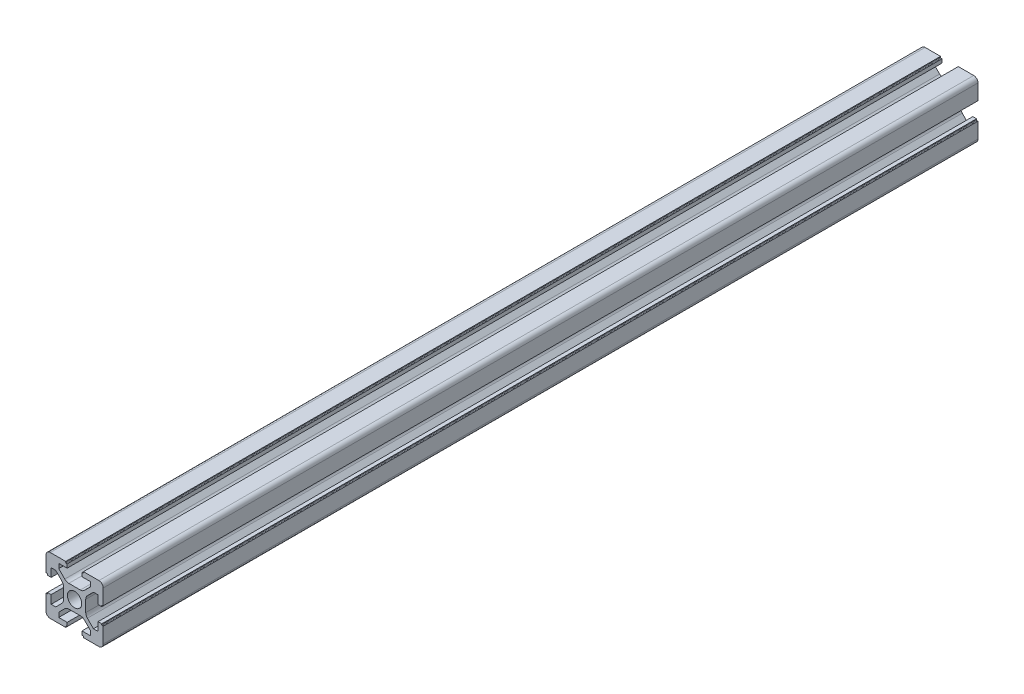
from build123d import *

# Parameters (mm, degrees)
SKETCH1_R      = 2.5
EXTRUDE1_DEPTH = 306


with BuildPart() as part:
    # Sketch1 → Extrude1 (new body)
    with BuildSketch(Plane.XY):
        with BuildLine():
            Line((0, 3.9), (-2.010912703, 3.9))
            ThreePointArc((-2.010912703, 3.9), (-2.776279568, 4.052240935), (-3.425126266, 4.485786438))
            Line((-3.425126266, 4.485786438), (-5.539339828, 6.6))
            Line((-5.539339828, 6.6), (-5.539339828, 8.2))
            Line((-5.539339828, 8.2), (-2.6, 8.2))
            Line((-2.6, 8.2), (-2.6, 9.5))
            Line((-2.6, 9.5), (-2.9, 9.5))
            ThreePointArc((-2.9, 9.5), (-3.041421356, 9.558578644), (-3.1, 9.7))
            Line((-3.1, 9.7), (-3.1, 10))
            Line((-3.1, 10), (-8.5, 10))
            ThreePointArc((-8.5, 10), (-9.560660172, 9.560660172), (-10, 8.5))
            Line((-10, 8.5), (-10, 3.1))
            Line((-10, 3.1), (-9.7, 3.1))
            ThreePointArc((-9.7, 3.1), (-9.558578644, 3.041421356), (-9.5, 2.9))
            Line((-9.5, 2.9), (-9.5, 2.6))
            Line((-9.5, 2.6), (-8.2, 2.6))
            Line((-8.2, 2.6), (-8.2, 5.539339828))
            Line((-8.2, 5.539339828), (-6.6, 5.539339828))
            Line((-6.6, 5.539339828), (-4.485786438, 3.425126266))
            ThreePointArc((-4.485786438, 3.425126266), (-4.052240935, 2.776279568), (-3.9, 2.010912703))
            Line((-3.9, 2.010912703), (-3.9, 0))
            Line((-3.9, 0), (-3.9, -2.010912703))
            ThreePointArc((-3.9, -2.010912703), (-4.052240935, -2.776279568), (-4.485786438, -3.425126266))
            Line((-4.485786438, -3.425126266), (-6.6, -5.539339828))
            Line((-6.6, -5.539339828), (-8.2, -5.539339828))
            Line((-8.2, -5.539339828), (-8.2, -2.6))
            Line((-8.2, -2.6), (-9.5, -2.6))
            Line((-9.5, -2.6), (-9.5, -2.9))
            ThreePointArc((-9.5, -2.9), (-9.558578644, -3.041421356), (-9.7, -3.1))
            Line((-9.7, -3.1), (-10, -3.1))
            Line((-10, -3.1), (-10, -8.5))
            ThreePointArc((-10, -8.5), (-9.560660172, -9.560660172), (-8.5, -10))
            Line((-8.5, -10), (-3.1, -10))
            Line((-3.1, -10), (-3.1, -9.7))
            ThreePointArc((-3.1, -9.7), (-3.041421356, -9.558578644), (-2.9, -9.5))
            Line((-2.9, -9.5), (-2.6, -9.5))
            Line((-2.6, -9.5), (-2.6, -8.2))
            Line((-2.6, -8.2), (-5.539339828, -8.2))
            Line((-5.539339828, -8.2), (-5.539339828, -6.6))
            Line((-5.539339828, -6.6), (-3.425126266, -4.485786438))
            ThreePointArc((-3.425126266, -4.485786438), (-2.776279568, -4.052240935), (-2.010912703, -3.9))
            Line((-2.010912703, -3.9), (0, -3.9))
            Line((0, -3.9), (2.010912703, -3.9))
            ThreePointArc((2.010912703, -3.9), (2.776279568, -4.052240935), (3.425126266, -4.485786438))
            Line((3.425126266, -4.485786438), (5.539339828, -6.6))
            Line((5.539339828, -6.6), (5.539339828, -8.2))
            Line((5.539339828, -8.2), (2.6, -8.2))
            Line((2.6, -8.2), (2.6, -9.5))
            Line((2.6, -9.5), (2.9, -9.5))
            ThreePointArc((2.9, -9.5), (3.041421356, -9.558578644), (3.1, -9.7))
            Line((3.1, -9.7), (3.1, -10))
            Line((3.1, -10), (8.5, -10))
            ThreePointArc((8.5, -10), (9.560660172, -9.560660172), (10, -8.5))
            Line((10, -8.5), (10, -3.1))
            Line((10, -3.1), (9.7, -3.1))
            ThreePointArc((9.7, -3.1), (9.558578644, -3.041421356), (9.5, -2.9))
            Line((9.5, -2.9), (9.5, -2.6))
            Line((9.5, -2.6), (8.2, -2.6))
            Line((8.2, -2.6), (8.2, -5.539339828))
            Line((8.2, -5.539339828), (6.6, -5.539339828))
            Line((6.6, -5.539339828), (4.485786438, -3.425126266))
            ThreePointArc((4.485786438, -3.425126266), (4.052240935, -2.776279568), (3.9, -2.010912703))
            Line((3.9, -2.010912703), (3.9, 0))
            Line((3.9, 0), (3.9, 2.010912703))
            ThreePointArc((3.9, 2.010912703), (4.052240935, 2.776279568), (4.485786438, 3.425126266))
            Line((4.485786438, 3.425126266), (6.6, 5.539339828))
            Line((6.6, 5.539339828), (8.2, 5.539339828))
            Line((8.2, 5.539339828), (8.2, 2.6))
            Line((8.2, 2.6), (9.5, 2.6))
            Line((9.5, 2.6), (9.5, 2.9))
            ThreePointArc((9.5, 2.9), (9.558578644, 3.041421356), (9.7, 3.1))
            Line((9.7, 3.1), (10, 3.1))
            Line((10, 3.1), (10, 8.5))
            ThreePointArc((10, 8.5), (9.560660172, 9.560660172), (8.5, 10))
            Line((8.5, 10), (3.1, 10))
            Line((3.1, 10), (3.1, 9.7))
            ThreePointArc((3.1, 9.7), (3.041421356, 9.558578644), (2.9, 9.5))
            Line((2.9, 9.5), (2.6, 9.5))
            Line((2.6, 9.5), (2.6, 8.2))
            Line((2.6, 8.2), (5.539339828, 8.2))
            Line((5.539339828, 8.2), (5.539339828, 6.6))
            Line((5.539339828, 6.6), (3.425126266, 4.485786438))
            ThreePointArc((3.425126266, 4.485786438), (2.776279568, 4.052240935), (2.010912703, 3.9))
            Line((2.010912703, 3.9), (0, 3.9))
        make_face()
        Circle(SKETCH1_R, mode=Mode.SUBTRACT)
    extrude(amount=EXTRUDE1_DEPTH)


solid = part.part
